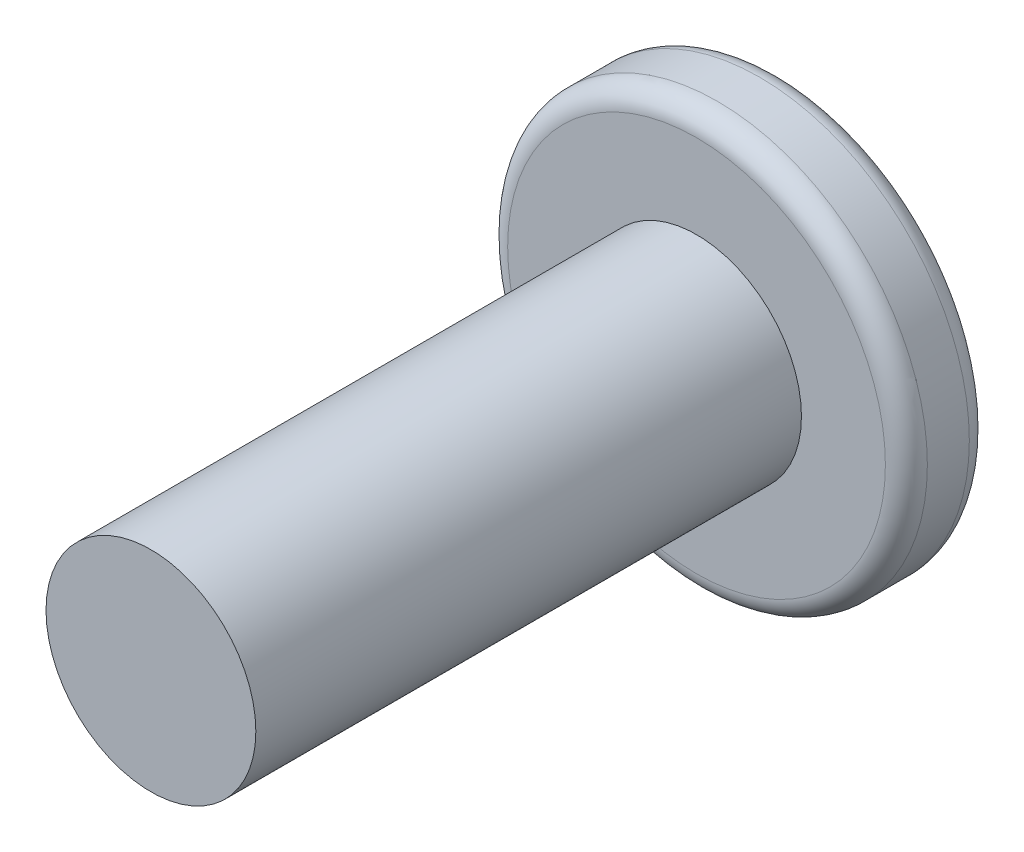
from build123d import *

# Parameters (mm, degrees)
CUT_EXTRUDE_2_DEPTH = 1.5


with BuildPart() as part:
    # 草图1 → 旋转1 (revolve)
    with BuildSketch(Plane(origin=(0, 0, 0), x_dir=(1, 0, 0), z_dir=(0, 1, 0)), mode=Mode.PRIVATE) as revolve_1_sk:
        with BuildLine():
            Line((0, 0), (0, -5.2))
            Line((0, -5.2), (1, -5.2))
            Line((1, -5.2), (1, 0))
            Line((1, 0), (1.8, 0))
            ThreePointArc((1.8, 0), (1.941421356, 0.058578644), (2, 0.2))
            Line((2, 0.2), (2, 0.6))
            ThreePointArc((2, 0.6), (1.941421356, 0.741421356), (1.8, 0.8))
            Line((1.8, 0.8), (0, 0.8))
            Line((0, 0.8), (0, 0))
        make_face()
    revolve(revolve_1_sk.sketch.rotate(Axis((0, 0, 0), (0, 0, 1)), 180), axis=Axis((0, 0, 0), (0, 0, 1)))

    # 草图3 → 切除-拉伸2 (cut)
    with BuildSketch(Plane(origin=(0, 0, -0.8), x_dir=(-1, 0, 0), z_dir=(0, 0, -1))):
        Polygon((0.866025404, 0), (0.433012702, 0.75), (-0.433012702, 0.75), (-0.866025404, 0), (-0.433012702, -0.75), (0.433012702, -0.75), align=None)
    extrude(amount=-CUT_EXTRUDE_2_DEPTH, mode=Mode.SUBTRACT)


solid = part.part
